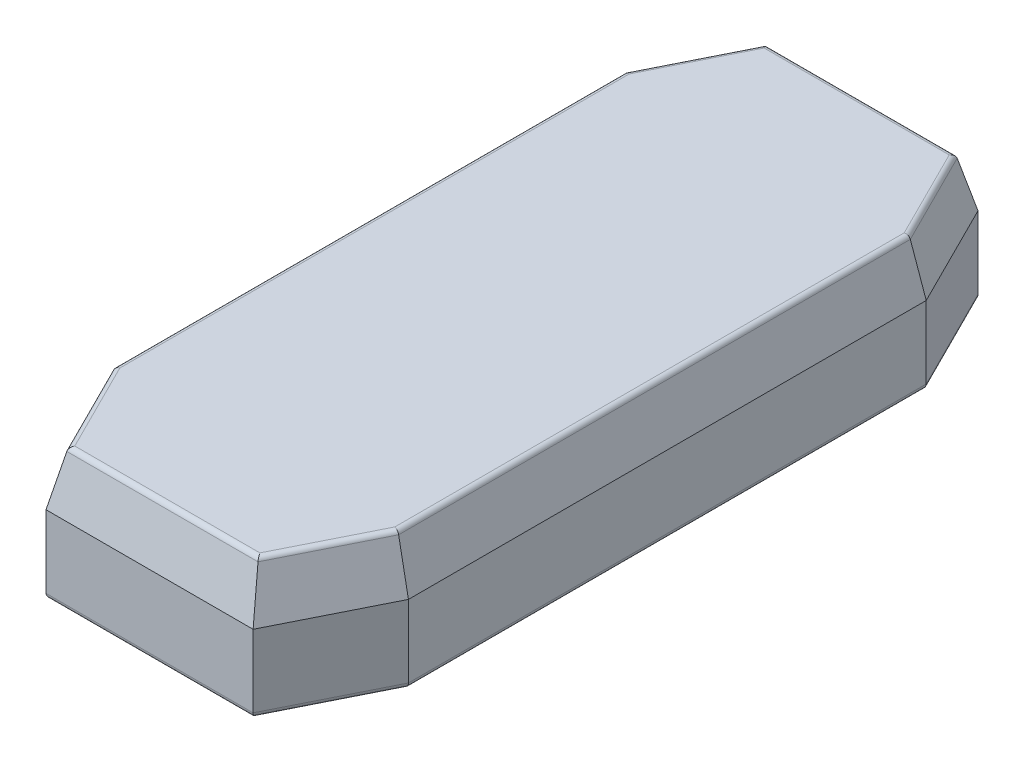
from build123d import *

# Parameters (mm, degrees)
BOSS_EXTRUDE1_DEPTH = 2.54
BOSS_EXTRUDE1_TAPER = 15
BOSS_EXTRUDE2_DEPTH = 3.8
FILLET2_R           = 0.1
CHAMFER1_SIZE       = 0.2
BOSS_EXTRUDE3_DEPTH = 3.8
FILLET3_R           = 0.25
FILLET5_R           = 0.5
FILLET6_R           = 0.1
FILLET7_R           = 0.25


with BuildPart() as part:
    # Sketch1 → Boss-Extrude1 (new body)
    with BuildSketch(Plane(origin=(0, 0, 0), x_dir=(1, 0, 0), z_dir=(0, 1, 0))):
        Polygon((-7.62, 12.7), (-7.62, -12.7), (-5.08, -17.78), (5.08, -17.78), (7.62, -12.7), (7.62, 12.7), (5.08, 17.78), (-5.08, 17.78), align=None)
    extrude(amount=BOSS_EXTRUDE1_DEPTH, taper=BOSS_EXTRUDE1_TAPER)

    # Stem → Boss-Extrude2 (add)
    with BuildSketch(Plane.XZ):
        with BuildLine():
            Line((2.499999969, 2.5), (-2.499999969, 2.5))
            ThreePointArc((-2.499999969, 2.5), (-2.85355336, 2.353553391), (-2.999999969, 2))
            Line((-2.999999969, 2), (-2.999999969, -2))
            ThreePointArc((-2.999999969, -2), (-2.85355336, -2.353553391), (-2.499999969, -2.5))
            Line((-2.499999969, -2.5), (2.499999969, -2.5))
            ThreePointArc((2.499999969, -2.5), (2.85355336, -2.353553391), (2.999999969, -2))
            Line((2.999999969, -2), (2.999999969, 2))
            ThreePointArc((2.999999969, 2), (2.85355336, 2.353553391), (2.499999969, 2.5))
        make_face()
        Polygon((-0.5625, 0.6625), (-0.5625, 2.075), (0.5625, 2.075), (0.5625, 0.6625), (2.0625, 0.6625), (2.0625, -0.6625), (0.5625, -0.6625), (0.5625, -2.075), (-0.5625, -2.075), (-0.5625, -0.6625), (-2.0625, -0.6625), (-2.0625, 0.6625), align=None, mode=Mode.SUBTRACT)
    extrude(amount=BOSS_EXTRUDE2_DEPTH)

    # Fillet2
    fillet2_edges = [part.edges().sort_by_distance(p)[0] for p in [
        (2.85355336, -3.8, 2.353553391),
        (0, -3.8, 2.5),
        (2.999999969, -3.8, 0),
        (-2.85355336, -3.8, 2.353553391),
        (-2.999999969, -3.8, 0),
        (-2.85355336, -3.8, -2.353553391),
        (0, -3.8, -2.5),
        (2.85355336, -3.8, -2.353553391),
    ]]
    fillet(fillet2_edges, radius=FILLET2_R)

    # Chamfer1
    chamfer1_edges = [part.edges().sort_by_distance(p)[0] for p in [
        (-2.0625, -3.8, 0),
        (-1.3125, -3.8, 0.6625),
        (-0.5625, -3.8, 1.36875),
        (1.3125, -3.8, 0.6625),
        (-0.5625, -3.8, -1.36875),
        (0, -3.8, 2.075),
        (0.5625, -3.8, 1.36875),
        (2.0625, -3.8, 0),
        (1.3125, -3.8, -0.6625),
        (0.5625, -3.8, -1.36875),
        (-1.3125, -3.8, -0.6625),
    ]]
    chamfer(chamfer1_edges, length=CHAMFER1_SIZE)

    # Sketch3 → Boss-Extrude3 (add)
    with BuildSketch(Plane.XZ):
        Polygon((-7.62, 12.7), (-7.62, -12.7), (-5.08, -17.78), (5.08, -17.78), (7.62, -12.7), (7.62, 12.7), (5.08, 17.78), (-5.08, 17.78), align=None)
        Polygon((-6.35, -12.400193669), (-4.295096834, -16.51), (4.295096834, -16.51), (6.35, -12.400193669), (6.35, 12.400193669), (4.295096834, 16.51), (-4.295096834, 16.51), (-6.35, 12.400193669), align=None, mode=Mode.SUBTRACT)
    extrude(amount=BOSS_EXTRUDE3_DEPTH)

    # Fillet3
    fillet3_edges = [part.edges().sort_by_distance(p)[0] for p in [
        (-6.35, -3.8, 15.24),
        (-7.62, -3.8, 0),
        (-6.35, -3.8, -15.24),
        (0, -3.8, -17.78),
        (6.35, -3.8, -15.24),
        (7.62, -3.8, 0),
        (6.35, -3.8, 15.24),
        (0, -3.8, 17.78),
        (-6.35, -3.8, 0),
        (-5.322548417, -3.8, -14.455096834),
        (0, -3.8, -16.51),
        (5.322548417, -3.8, -14.455096834),
        (6.35, -3.8, 0),
        (5.322548417, -3.8, 14.455096834),
        (0, -3.8, 16.51),
        (-5.322548417, -3.8, 14.455096834),
    ]]
    fillet(fillet3_edges, radius=FILLET3_R)

    # Fillet5
    fillet5_edges = [part.edges().sort_by_distance(p)[0] for p in [
        (-6.35, 0, 0),
        (-5.322548417, 0, -14.455096834),
        (0, 0, -16.51),
        (5.322548417, 0, -14.455096834),
        (6.35, 0, 0),
        (5.322548417, 0, 14.455096834),
        (0, 0, 16.51),
        (-5.322548417, 0, 14.455096834),
        (-2.85355336, 0, 2.353553391),
        (-2.999999969, 0, 0),
        (-2.85355336, 0, -2.353553391),
        (0, 0, -2.5),
        (2.85355336, 0, -2.353553391),
        (2.85355336, 0, 2.353553391),
        (2.999999969, 0, 0),
        (0, 0, 2.5),
    ]]
    fillet(fillet5_edges, radius=FILLET5_R)

    # Fillet6
    fillet6_edges = [part.edges().sort_by_distance(p)[0] for p in [
        (0, 0, 2.075),
        (0.5625, 0, 1.36875),
        (2.0625, 0, 0),
        (1.3125, 0, -0.6625),
        (0.5625, 0, -1.36875),
        (-1.3125, 0, -0.6625),
        (-2.0625, 0, 0),
        (-0.5625, 0, -1.36875),
        (0, 0, -2.075),
        (1.3125, 0, 0.6625),
        (-0.5625, 0, 1.36875),
        (-1.3125, 0, 0.6625),
    ]]
    fillet(fillet6_edges, radius=FILLET6_R)

    # Fillet7
    fillet7_edges = [part.edges().sort_by_distance(p)[0] for p in [
        (-6.939409051, 2.54, 0),
        (-5.799390356, 2.54, 14.819371661),
        (0, 2.54, 17.099409051),
        (5.799390356, 2.54, 14.819371661),
        (6.939409051, 2.54, 0),
        (5.799390356, 2.54, -14.819371661),
        (0, 2.54, -17.099409051),
        (-5.799390356, 2.54, -14.819371661),
    ]]
    fillet(fillet7_edges, radius=FILLET7_R)


solid = part.part
